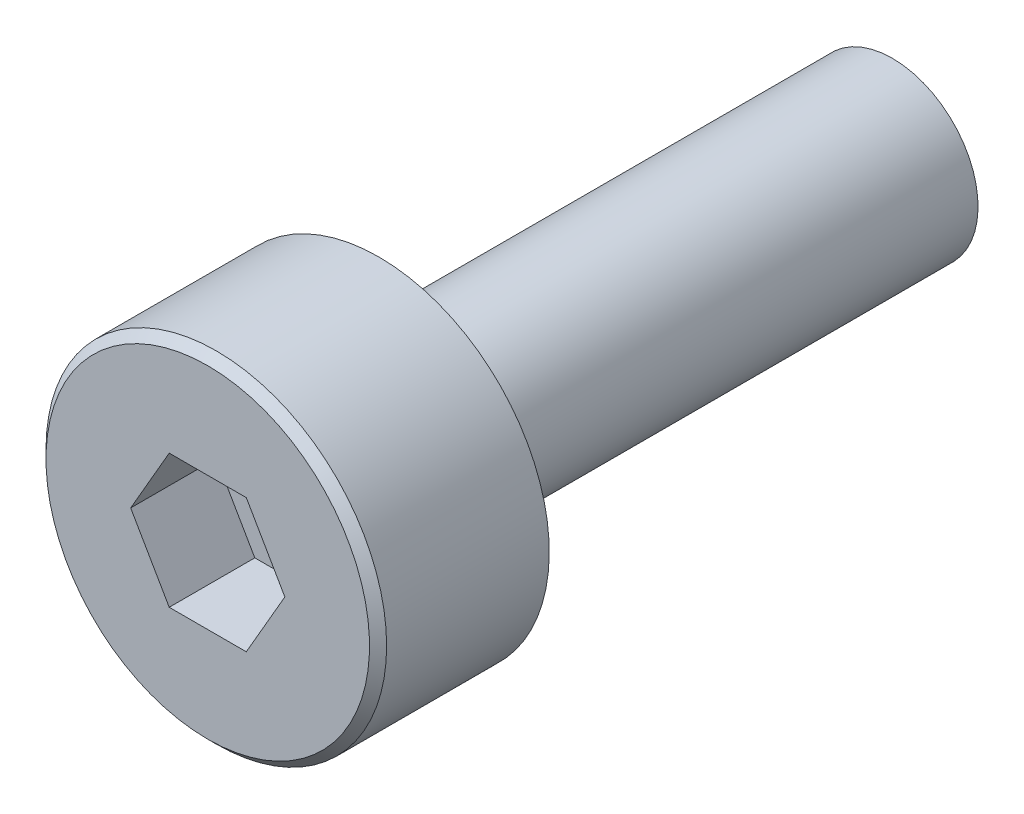
from build123d import *

# Parameters (mm, degrees)
CUT_EXTRUDE_1_DEPTH = 1
CHAMFER_627_SIZE    = 0.1


with BuildPart() as part:
    # 草图1 → 旋转1 (revolve)
    with BuildSketch(Plane(origin=(0, 0, 0), x_dir=(0, 0, -1), z_dir=(1, 0, 0))):
        Polygon((0, 0), (0, 1.99), (2, 1.99), (2, 1), (8, 1), (8, 0), align=None)
    revolve(axis=Axis((0, 0, -8), (0, 0, 1)))

    # 草图2 → 切除-拉伸1 (cut)
    with BuildSketch(Plane.XY):
        Polygon((0.45033321, 0.78), (-0.45033321, 0.78), (-0.90066642, 0), (-0.45033321, -0.78), (0.45033321, -0.78), (0.90066642, 0), align=None)
    extrude(amount=-CUT_EXTRUDE_1_DEPTH, mode=Mode.SUBTRACT)

    # Chamfer 627
    chamfer_627_edges = [part.edges().sort_by_distance(p)[0] for p in [
        (0, -1.99, 0),
    ]]
    chamfer(chamfer_627_edges, length=CHAMFER_627_SIZE)


solid = part.part
